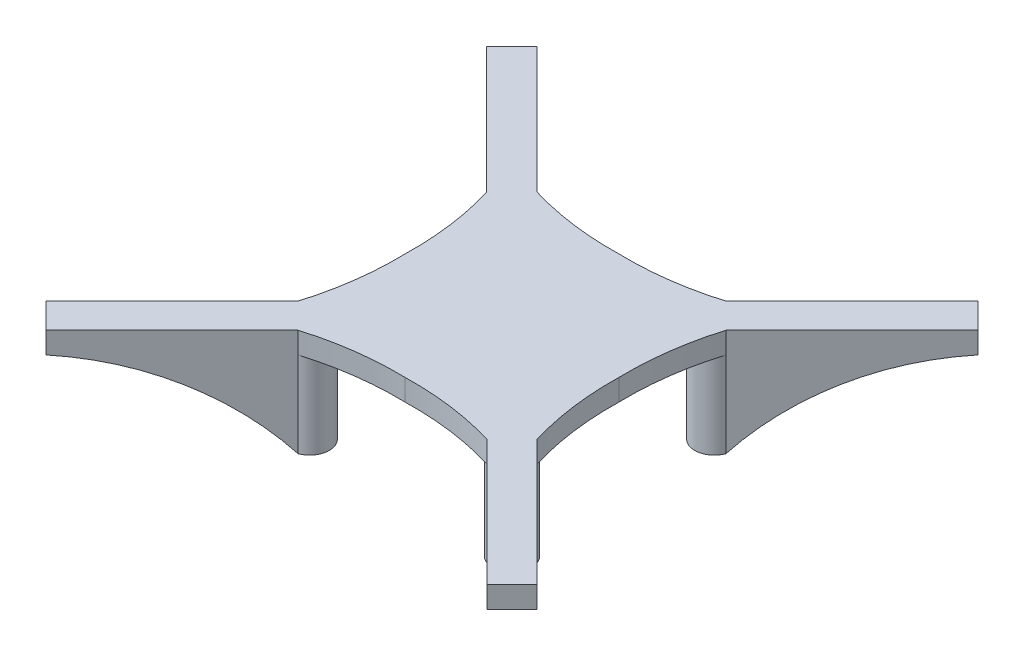
from build123d import *

# Parameters (mm, degrees)
P_IDAT_VYSUNUT_M2_DEPTH  = 30
ODEBRAT_VYSUNUT_M1_DEPTH = 30
ODEBRAT_VYSUNUT_M2_DEPTH = 30
ODEBRAT_VYSUNUT_M3_DEPTH = 30
ODEBRAT_VYSUNUT_M4_DEPTH = 30
ODEBRAT_VYSUNUT_M5_DEPTH = 24


with BuildPart() as part:
    # Skica2 → Přidat vysunutím2 (new body)
    with BuildSketch(Plane(origin=(0, 0, 0), x_dir=(1, 0, 0), z_dir=(0, 1, 0))):
        with BuildLine():
            Line((-68.909987848, 61.819805153), (-33.554648789, 26.464466094))
            ThreePointArc((-33.554648789, 26.464466094), (-30.731632254, 13.372688112), (-30, 0))
            ThreePointArc((-30, 0), (-30.722175449, -13.37191938), (-33.535533906, -26.464466094))
            Line((-33.535533906, -26.464466094), (-68.890872965, -61.819805153))
            Line((-68.890872965, -61.819805153), (-61.819805153, -68.890872965))
            Line((-61.819805153, -68.890872965), (-26.464466094, -33.535533906))
            ThreePointArc((-26.464466094, -33.535533906), (-13.37191938, -30.722175449), (0, -30))
            ThreePointArc((0, -30), (13.37191938, -30.722175449), (26.464466094, -33.535533906))
            Line((26.464466094, -33.535533906), (61.819805153, -68.890872965))
            Line((61.819805153, -68.890872965), (68.890872965, -61.819805153))
            Line((68.890872965, -61.819805153), (33.535533906, -26.464466094))
            ThreePointArc((33.535533906, -26.464466094), (30.722175449, -13.37191938), (30, 0))
            ThreePointArc((30, 0), (30.722175449, 13.37191938), (33.535533906, 26.464466094))
            Line((33.535533906, 26.464466094), (68.890872965, 61.819805153))
            Line((68.890872965, 61.819805153), (61.819805153, 68.890872965))
            Line((61.819805153, 68.890872965), (26.464466094, 33.535533906))
            ThreePointArc((26.464466094, 33.535533906), (13.37191938, 30.722175449), (0, 30))
            ThreePointArc((0, 30), (-13.381577193, 30.72066838), (-26.483580977, 33.535533906))
            Line((-26.483580977, 33.535533906), (-61.838920037, 68.890872965))
            Line((-61.838920037, 68.890872965), (-68.909987848, 61.819805153))
        make_face()
    extrude(amount=P_IDAT_VYSUNUT_M2_DEPTH)

    # Skica4 → Odebrat vysunutím1 (cut)
    with BuildSketch(Plane(origin=(3.535533906, 0, -3.535533906), x_dir=(-0.707106781186553, 0, -0.7071067811865421), z_dir=(0.7071067811865421, 0, -0.707106781186553))):
        with BuildLine():
            Line((-42.426406871, 0), (-92.426406871, 0))
            Line((-92.426406871, 0), (-92.426406871, 24))
            ThreePointArc((-92.426406871, 24), (-65.126443653, 16.791590037), (-42.426406871, 0))
        make_face()
    extrude(amount=-ODEBRAT_VYSUNUT_M1_DEPTH, mode=Mode.SUBTRACT)

    # Skica5 → Odebrat vysunutím2 (cut)
    with BuildSketch(Plane(origin=(3.535533906, 0, 3.535533906), x_dir=(0.7071067811865475, 0, -0.7071067811865477), z_dir=(0.7071067811865477, 0, 0.7071067811865475))):
        with BuildLine():
            Line((-92.426406871, 0), (-92.426406871, 24))
            ThreePointArc((-92.426406871, 24), (-65.126443653, 16.791590037), (-42.426406871, 0))
            Line((-42.426406871, 0), (-92.426406871, 0))
        make_face()
    extrude(amount=-ODEBRAT_VYSUNUT_M2_DEPTH, mode=Mode.SUBTRACT)

    # Skica6 → Odebrat vysunutím3 (cut)
    with BuildSketch(Plane(origin=(-3.545091348, 0, 3.545091348), x_dir=(0.7071067811865475, 0, 0.7071067811865476), z_dir=(-0.7071067811865476, 0, 0.7071067811865475))):
        with BuildLine():
            Line((-92.439923135, 0), (-92.439923135, 24))
            ThreePointArc((-92.439923135, 24), (-65.139959917, 16.791590037), (-42.439923135, 0))
            Line((-42.439923135, 0), (-92.439923135, 0))
        make_face()
    extrude(amount=-ODEBRAT_VYSUNUT_M3_DEPTH, mode=Mode.SUBTRACT)

    # Skica7 → Odebrat vysunutím4 (cut)
    with BuildSketch(Plane(origin=(-3.535533906, 0, -3.535533906), x_dir=(-0.7071067811865472, 0, 0.7071067811865478), z_dir=(-0.7071067811865478, 0, -0.7071067811865472))):
        with BuildLine():
            Line((-92.426406871, 0), (-92.426406871, 24))
            ThreePointArc((-92.426406871, 24), (-65.126443653, 16.791590037), (-42.426406871, 0))
            Line((-42.426406871, 0), (-92.426406871, 0))
        make_face()
    extrude(amount=-ODEBRAT_VYSUNUT_M4_DEPTH, mode=Mode.SUBTRACT)

    # Skica8 → Odebrat vysunutím5 (cut)
    with BuildSketch(Plane.XZ):
        with BuildLine():
            Line((-33.554648789, -26.464466094), (-33.535533906, 26.464466094))
            ThreePointArc((-33.535533906, 26.464466094), (-24.490727529, 24.490727529), (-26.464466094, 33.535533906))
            Line((-26.464466094, 33.535533906), (26.464466094, 33.535533906))
            ThreePointArc((26.464466094, 33.535533906), (24.490727529, 24.490727529), (33.535533906, 26.464466094))
            Line((33.535533906, 26.464466094), (33.535533906, -26.464466094))
            ThreePointArc((33.535533906, -26.464466094), (24.490727529, -24.490727529), (26.464466094, -33.535533906))
            Line((26.464466094, -33.535533906), (-26.483580977, -33.535533906))
            ThreePointArc((-26.483580977, -33.535533906), (-24.509842412, -24.490727529), (-33.554648789, -26.464466094))
        make_face()
    extrude(amount=-ODEBRAT_VYSUNUT_M5_DEPTH, mode=Mode.SUBTRACT)


solid = part.part
